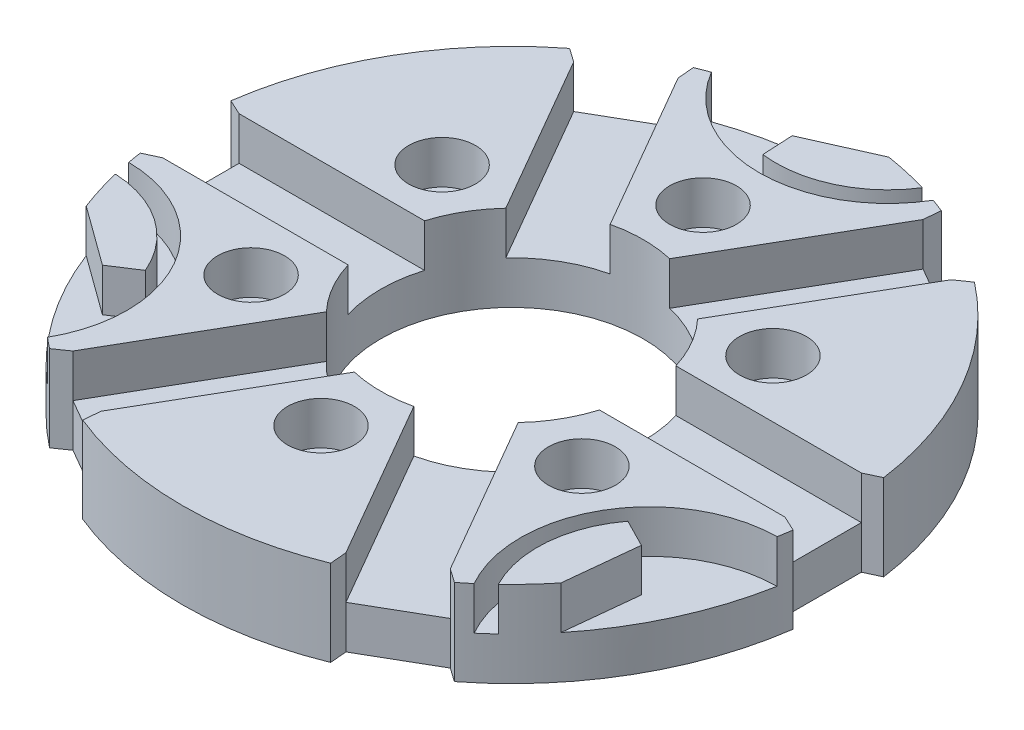
from build123d import *

# Parameters (mm, degrees)
BOSS_EXTRUDE2_DEPTH   = 18
BOSS_EXTRUDE2_2_DEPTH = 18
BOSS_EXTRUDE2_3_DEPTH = 18
BOSS_EXTRUDE2_4_DEPTH = 18
BOSS_EXTRUDE2_5_DEPTH = 18
BOSS_EXTRUDE2_6_DEPTH = 18
BOSS_EXTRUDE3_DEPTH   = 9
SKETCH2_R             = 7
SKETCH2_R_2           = 4.5
CUT_EXTRUDE1_DEPTH    = 9
SKETCH2_3_R           = 4.5
CUT_EXTRUDE2_DEPTH    = 18
CUT_EXTRUDE3_START    = -9
CUT_EXTRUDE3_DEPTH    = 9


with BuildPart() as part:
    # Sketch1 → Boss-Extrude2 (new body)
    with BuildSketch(Plane(origin=(0, 0, 0), x_dir=(1, 0, 0), z_dir=(0, 1, 0))):
        with BuildLine():
            ThreePointArc((26.310644234, -8), (23.815698604, -13.75), (20.083525347, -18.785686296))
            Line((20.083525347, -18.785686296), (39.506230912, -52.426799156))
            Line((39.506230912, -52.426799156), (42.388242893, -54.44480567))
            ThreePointArc((42.388242893, -54.44480567), (59.755752861, -34.5), (68.344706261, -9.486892332))
            Line((68.344706261, -9.486892332), (65.156055364, -8))
            Line((65.156055364, -8), (26.310644234, -8))
        make_face()
    extrude(amount=BOSS_EXTRUDE2_DEPTH)



with BuildPart() as body_2:
    # Sketch1 → Boss-Extrude2 2 (new body)
    with BuildSketch(Plane(origin=(0, 0, 0), x_dir=(1, 0, 0), z_dir=(0, 1, 0))):
        with BuildLine():
            Line((25.649824452, -60.426799156), (6.227118887, -26.785686296))
            ThreePointArc((6.227118887, -26.785686296), (0, -27.5), (-6.227118887, -26.785686296))
            Line((-6.227118887, -26.785686296), (-25.649824452, -60.426799156))
            Line((-25.649824452, -60.426799156), (-25.956463368, -63.931698002))
            ThreePointArc((-25.956463368, -63.931698002), (0, -69), (25.956463368, -63.931698002))
            Line((25.956463368, -63.931698002), (25.649824452, -60.426799156))
        make_face()
    extrude(amount=BOSS_EXTRUDE2_2_DEPTH)


with BuildPart() as body_3:
    # Sketch1 → Boss-Extrude2 3 (new body)
    with BuildSketch(Plane(origin=(0, 0, 0), x_dir=(1, 0, 0), z_dir=(0, 1, 0))):
        with BuildLine():
            Line((-39.506230912, -52.426799156), (-20.083525347, -18.785686296))
            ThreePointArc((-20.083525347, -18.785686296), (-23.815698604, -13.75), (-26.310644234, -8))
            Line((-26.310644234, -8), (-65.156055364, -8))
            Line((-65.156055364, -8), (-68.344706261, -9.486892332))
            ThreePointArc((-68.344706261, -9.486892332), (-59.755752861, -34.5), (-42.388242893, -54.44480567))
            Line((-42.388242893, -54.44480567), (-39.506230912, -52.426799156))
        make_face()
    extrude(amount=BOSS_EXTRUDE2_3_DEPTH)


with BuildPart() as body_4:
    # Sketch1 → Boss-Extrude2 4 (new body)
    with BuildSketch(Plane(origin=(0, 0, 0), x_dir=(1, 0, 0), z_dir=(0, 1, 0))):
        with BuildLine():
            Line((26.310644234, 8), (65.156055364, 8))
            Line((65.156055364, 8), (68.344706261, 9.486892332))
            ThreePointArc((68.344706261, 9.486892332), (59.755752861, 34.5), (42.388242893, 54.44480567))
            Line((42.388242893, 54.44480567), (39.506230912, 52.426799156))
            Line((39.506230912, 52.426799156), (20.083525347, 18.785686296))
            ThreePointArc((20.083525347, 18.785686296), (23.815698604, 13.75), (26.310644234, 8))
        make_face()
    extrude(amount=BOSS_EXTRUDE2_4_DEPTH)


with BuildPart() as body_5:
    # Sketch1 → Boss-Extrude2 5 (new body)
    with BuildSketch(Plane(origin=(0, 0, 0), x_dir=(1, 0, 0), z_dir=(0, 1, 0))):
        with BuildLine():
            Line((-65.156055364, 8), (-26.310644234, 8))
            ThreePointArc((-26.310644234, 8), (-23.815698604, 13.75), (-20.083525347, 18.785686296))
            Line((-20.083525347, 18.785686296), (-39.506230912, 52.426799156))
            Line((-39.506230912, 52.426799156), (-42.388242893, 54.44480567))
            ThreePointArc((-42.388242893, 54.44480567), (-59.755752861, 34.5), (-68.344706261, 9.486892332))
            Line((-68.344706261, 9.486892332), (-65.156055364, 8))
        make_face()
    extrude(amount=BOSS_EXTRUDE2_5_DEPTH)


with BuildPart() as body_6:
    # Sketch1 → Boss-Extrude2 6 (new body)
    with BuildSketch(Plane(origin=(0, 0, 0), x_dir=(1, 0, 0), z_dir=(0, 1, 0))):
        with BuildLine():
            ThreePointArc((-6.227118887, 26.785686296), (0, 27.5), (6.227118887, 26.785686296))
            Line((6.227118887, 26.785686296), (25.649824452, 60.426799156))
            Line((25.649824452, 60.426799156), (25.956463368, 63.931698002))
            ThreePointArc((25.956463368, 63.931698002), (0, 69), (-25.956463368, 63.931698002))
            Line((-25.956463368, 63.931698002), (-25.649824452, 60.426799156))
            Line((-25.649824452, 60.426799156), (-6.227118887, 26.785686296))
        make_face()
    extrude(amount=BOSS_EXTRUDE2_6_DEPTH)


with BuildPart() as part_1:
    add(part.part)

    add(body_2.part)  # Boss-Extrude3 merges body 2

    add(body_3.part)  # Boss-Extrude3 merges body 3

    add(body_4.part)  # Boss-Extrude3 merges body 4

    add(body_5.part)  # Boss-Extrude3 merges body 5

    add(body_6.part)  # Boss-Extrude3 merges body 6
    # Sketch1<3> → Boss-Extrude3 (add)
    with BuildSketch(Plane(origin=(0, 0, 0), x_dir=(1, 0, 0), z_dir=(0, 1, 0))):
        with BuildLine():
            Line((39.506230912, -52.426799156), (20.083525347, -18.785686296))
            ThreePointArc((20.083525347, -18.785686296), (13.75, -23.815698604), (6.227118887, -26.785686296))
            Line((6.227118887, -26.785686296), (25.649824452, -60.426799156))
            Line((25.649824452, -60.426799156), (39.506230912, -52.426799156))
        make_face()
        with BuildLine():
            ThreePointArc((26.310644234, 8), (27.5, 0), (26.310644234, -8))
            Line((26.310644234, -8), (65.156055364, -8))
            Line((65.156055364, -8), (65.156055364, 8))
            Line((65.156055364, 8), (26.310644234, 8))
        make_face()
        with BuildLine():
            Line((-25.649824452, -60.426799156), (-6.227118887, -26.785686296))
            ThreePointArc((-6.227118887, -26.785686296), (-13.75, -23.815698604), (-20.083525347, -18.785686296))
            Line((-20.083525347, -18.785686296), (-39.506230912, -52.426799156))
            Line((-39.506230912, -52.426799156), (-25.649824452, -60.426799156))
        make_face()
        with BuildLine():
            Line((-65.156055364, -8), (-26.310644234, -8))
            ThreePointArc((-26.310644234, -8), (-27.5, 0), (-26.310644234, 8))
            Line((-26.310644234, 8), (-65.156055364, 8))
            Line((-65.156055364, 8), (-65.156055364, -8))
        make_face()
        with BuildLine():
            ThreePointArc((6.227118887, 26.785686296), (13.75, 23.815698604), (20.083525347, 18.785686296))
            Line((20.083525347, 18.785686296), (39.506230912, 52.426799156))
            Line((39.506230912, 52.426799156), (25.649824452, 60.426799156))
            Line((25.649824452, 60.426799156), (6.227118887, 26.785686296))
        make_face()
        with BuildLine():
            Line((-39.506230912, 52.426799156), (-20.083525347, 18.785686296))
            ThreePointArc((-20.083525347, 18.785686296), (-13.75, 23.815698604), (-6.227118887, 26.785686296))
            Line((-6.227118887, 26.785686296), (-25.649824452, 60.426799156))
            Line((-25.649824452, 60.426799156), (-39.506230912, 52.426799156))
        make_face()
    extrude(amount=BOSS_EXTRUDE3_DEPTH)

    # Sketch2 → Cut-Extrude1 (cut)
    # profile 1 of 6: a face of its own
    with BuildSketch(Plane(origin=(0, 18, 0), x_dir=(1, 0, 0), z_dir=(0, 1, 0))):
        with Locations((0, 40)):
            Circle(SKETCH2_R)
        with Locations((0, 40)):
            Circle(SKETCH2_R_2, mode=Mode.SUBTRACT)
    # profile 2 of 6: a face of its own
    with BuildSketch(Plane(origin=(0, 18, 0), x_dir=(1, 0, 0), z_dir=(0, 1, 0))):
        with Locations((34.641016151, 20)):
            Circle(SKETCH2_R)
        with Locations((34.641016151, 20)):
            Circle(SKETCH2_R_2, mode=Mode.SUBTRACT)
    # profile 3 of 6: a face of its own
    with BuildSketch(Plane(origin=(0, 18, 0), x_dir=(1, 0, 0), z_dir=(0, 1, 0))):
        with Locations((34.641016151, -20)):
            Circle(SKETCH2_R)
        with Locations((34.641016151, -20)):
            Circle(SKETCH2_R_2, mode=Mode.SUBTRACT)
    # profile 4 of 6: a face of its own
    with BuildSketch(Plane(origin=(0, 18, 0), x_dir=(1, 0, 0), z_dir=(0, 1, 0))):
        with Locations((0, -40)):
            Circle(SKETCH2_R)
        with Locations((0, -40)):
            Circle(SKETCH2_R_2, mode=Mode.SUBTRACT)
    # profile 5 of 6: a face of its own
    with BuildSketch(Plane(origin=(0, 18, 0), x_dir=(1, 0, 0), z_dir=(0, 1, 0))):
        with Locations((-34.641016151, -20)):
            Circle(SKETCH2_R)
        with Locations((-34.641016151, -20)):
            Circle(SKETCH2_R_2, mode=Mode.SUBTRACT)
    # profile 6 of 6: a face of its own
    with BuildSketch(Plane(origin=(0, 18, 0), x_dir=(1, 0, 0), z_dir=(0, 1, 0))):
        with Locations((-34.641016151, 20)):
            Circle(SKETCH2_R)
        with Locations((-34.641016151, 20)):
            Circle(SKETCH2_R_2, mode=Mode.SUBTRACT)
    extrude(amount=-CUT_EXTRUDE1_DEPTH, mode=Mode.SUBTRACT)

    # Sketch2<3> → Cut-Extrude2 (cut)
    with BuildSketch(Plane(origin=(0, 18, 0), x_dir=(1, 0, 0), z_dir=(0, 1, 0))):
        with Locations((0, 40)):
            Circle(SKETCH2_3_R)
        with Locations((34.641016151, 20)):
            Circle(SKETCH2_3_R)
        with Locations((34.641016151, -20)):
            Circle(SKETCH2_3_R)
        with Locations((0, -40)):
            Circle(SKETCH2_3_R)
        with Locations((-34.641016151, -20)):
            Circle(SKETCH2_3_R)
        with Locations((-34.641016151, 20)):
            Circle(SKETCH2_3_R)
    extrude(amount=-CUT_EXTRUDE2_DEPTH, mode=Mode.SUBTRACT)

    # Sketch6 → Cut-Extrude3 (cut)
    with BuildSketch(Plane(origin=(0, 18, 0), x_dir=(1, 0, 0), z_dir=(0, 1, 0)).offset(CUT_EXTRUDE3_START)):
        with BuildLine():
            Line((-46.551509731, -30.230903894), (-51.997575213, -33.767620171))
            Line((-51.997575213, -33.767620171), (-64.408016757, -24.750906597))
            ThreePointArc((-64.408016757, -24.750906597), (-56.283011493, -39.915192813), (-44.65912882, -52.598119862))
            ThreePointArc((-44.65912882, -52.598119862), (-44.816814646, -25.875), (-67.880872402, -12.376880138))
            ThreePointArc((-67.880872402, -12.376880138), (-67.535074395, -14.142620919), (-67.143353435, -15.898744905))
            ThreePointArc((-67.143353435, -15.898744905), (-54.774815631, -20.086976906), (-46.551509731, -30.230903894))
        make_face()
        with BuildLine():
            Line((-2.904975886, 55.430241959), (-3.244829287, 61.915031155))
            Line((-3.244829287, 61.915031155), (10.769094499, 68.154432018))
            ThreePointArc((10.769094499, 68.154432018), (-6.426065226, 68.700114161), (-23.221743582, 64.975))
            ThreePointArc((-23.221743582, 64.975), (0, 51.75), (23.221743582, 64.975))
            ThreePointArc((23.221743582, 64.975), (21.519668206, 65.558400532), (19.802959741, 66.097222222))
            ThreePointArc((19.802959741, 66.097222222), (9.99157553, 57.479870277), (-2.904975886, 55.430241959))
        make_face()
        with BuildLine():
            Line((49.456485617, -25.199338065), (55.2424045, -28.147410984))
            Line((55.2424045, -28.147410984), (53.638922259, -43.40352542))
            ThreePointArc((53.638922259, -43.40352542), (62.709076719, -28.784921348), (67.880872402, -12.376880138))
            ThreePointArc((67.880872402, -12.376880138), (44.816814646, -25.875), (44.65912882, -52.598119862))
            ThreePointArc((44.65912882, -52.598119862), (46.015406189, -51.415779613), (47.340393693, -50.198477317))
            ThreePointArc((47.340393693, -50.198477317), (44.783240101, -37.392893372), (49.456485617, -25.199338065))
        make_face()
    extrude(amount=CUT_EXTRUDE3_DEPTH, mode=Mode.SUBTRACT)


solid = part_1.part
